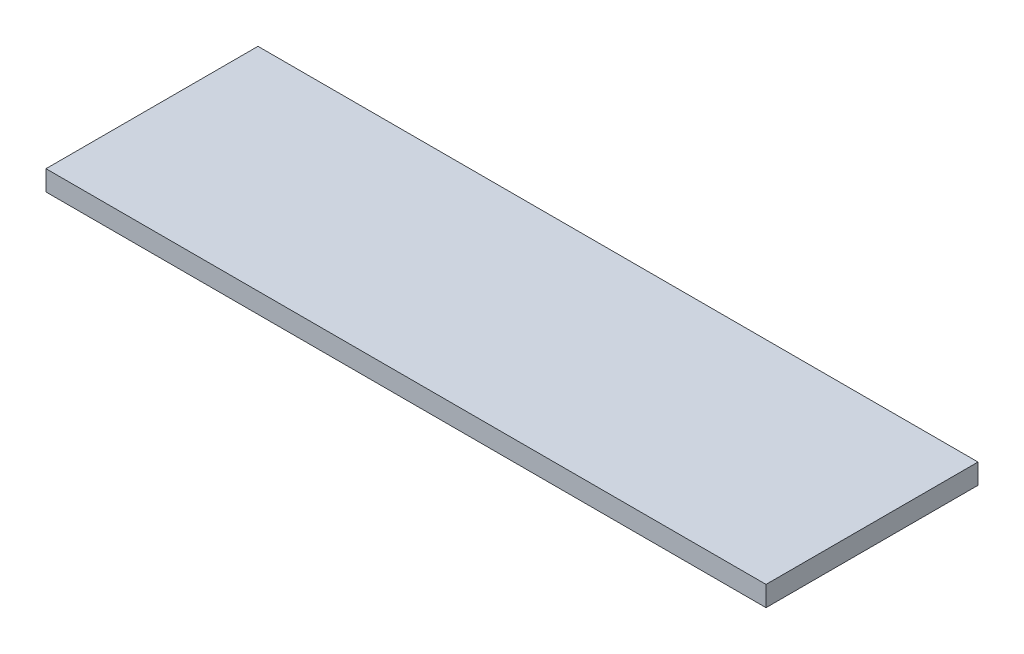
from build123d import *

# Parameters (mm, degrees)
SKETCH_1_W      = 107
SKETCH_1_H      = 31.5
EXTRUDE_1_DEPTH = 3


with BuildPart() as part:
    # Эскиз1 → Бобышка-Вытянуть1 (new body)
    with BuildSketch(Plane(origin=(0, 0, 0), x_dir=(1, 0, 0), z_dir=(0, 1, 0))):
        with Locations((53.5, -15.75)):
            Rectangle(SKETCH_1_W, SKETCH_1_H)
    extrude(amount=EXTRUDE_1_DEPTH)


solid = part.part
